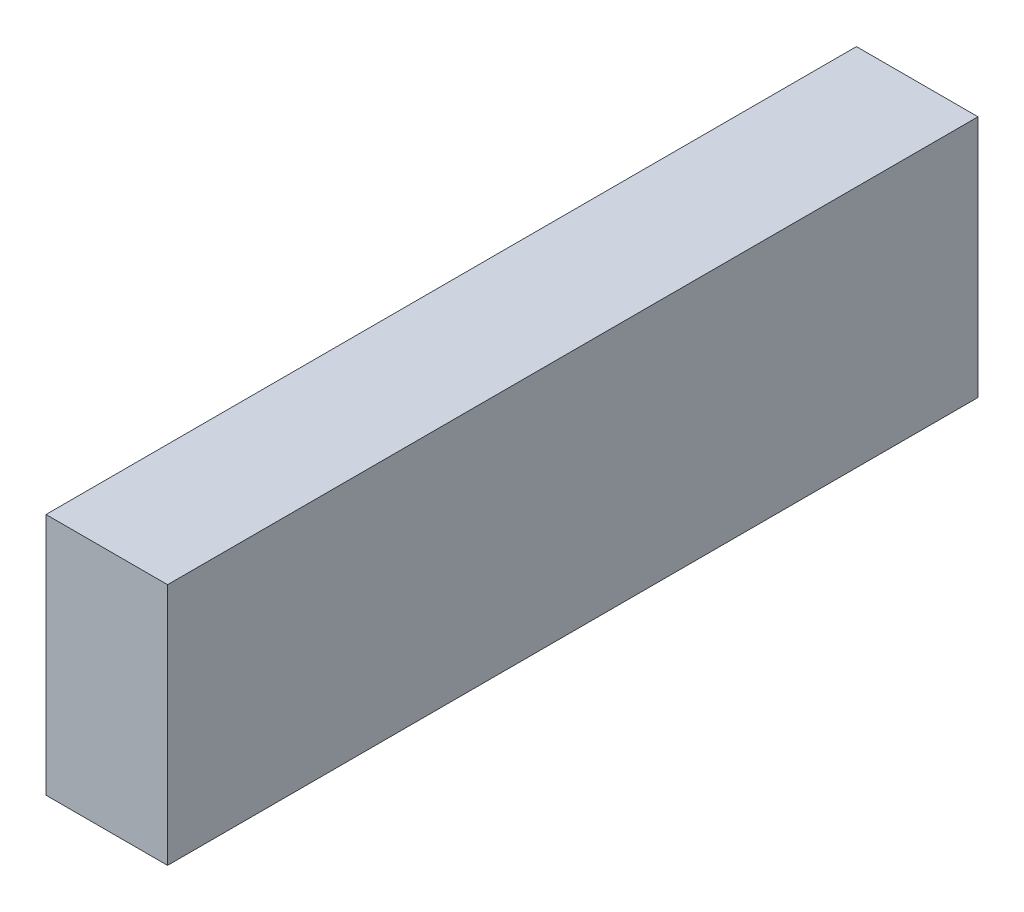
from build123d import *

# Parameters (mm, degrees)
SKETCH1_W           = 3
SKETCH1_H           = 6
BOSS_EXTRUDE1_DEPTH = 20


with BuildPart() as part:
    # Sketch1 → Boss-Extrude1 (new body)
    with BuildSketch(Plane.XY):
        Rectangle(SKETCH1_W, SKETCH1_H)
    extrude(amount=BOSS_EXTRUDE1_DEPTH)


solid = part.part
